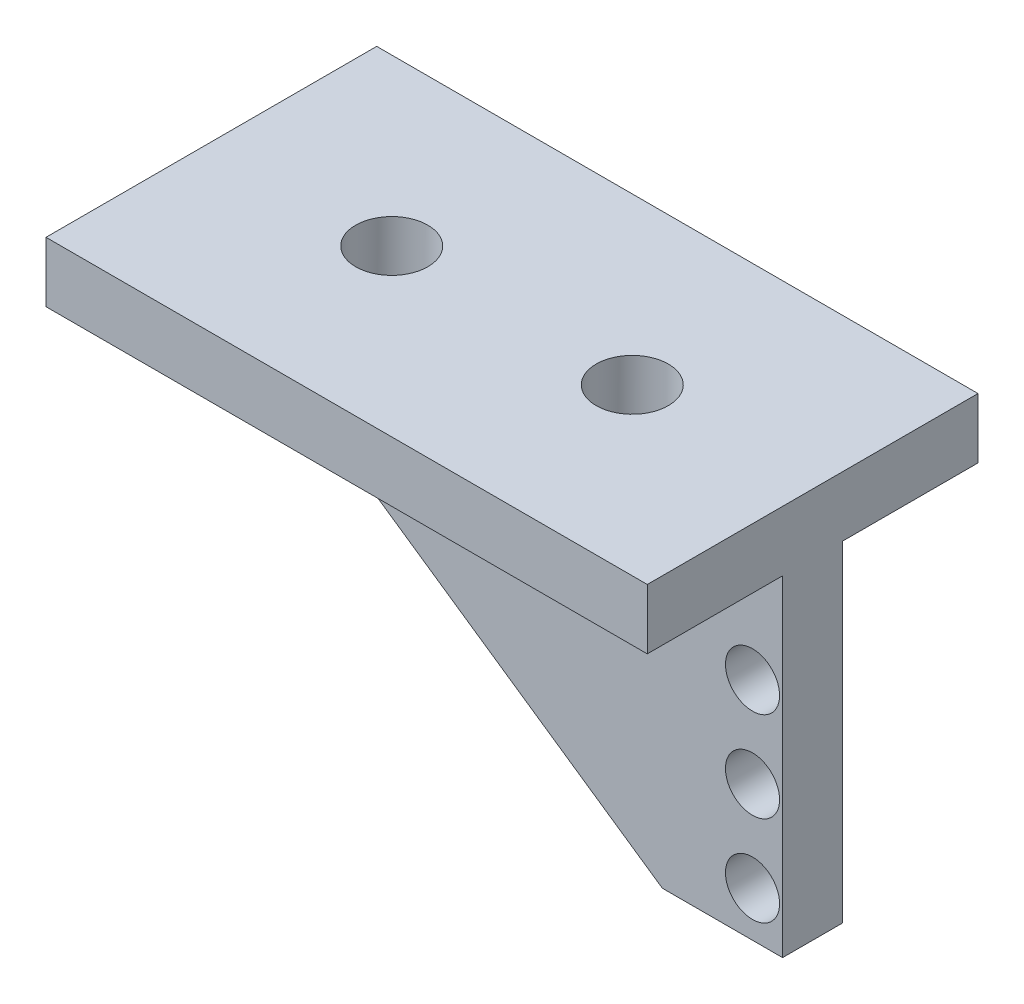
from build123d import *

# Parameters (mm, degrees)
SKETCH1_W           = 20
SKETCH1_H           = 11
BOSS_EXTRUDE1_DEPTH = 2
BOSS_EXTRUDE2_DEPTH = 2
SKETCH3_R           = 0.9
CUT_EXTRUDE1_DEPTH  = 2
SKETCH4_R           = 1.2
CUT_EXTRUDE2_DEPTH  = 2


with BuildPart() as part:
    # Sketch1 → Boss-Extrude1 (new body)
    with BuildSketch(Plane(origin=(0, 0, 0), x_dir=(1, 0, 0), z_dir=(0, 1, 0))):
        with Locations((-10, 0)):
            Rectangle(SKETCH1_W, SKETCH1_H)
    extrude(amount=-BOSS_EXTRUDE1_DEPTH)

    # Sketch2 → Boss-Extrude2 (add)
    with BuildSketch(Plane.XY.offset(-1)):
        Polygon((0, 0), (0, -13), (-4, -13), (-20, -2), (-20, 0), align=None)
    extrude(amount=BOSS_EXTRUDE2_DEPTH)

    # Sketch3 → Cut-Extrude1 (cut)
    with BuildSketch(Plane.XY.offset(-1)):
        with Locations((-1, -5.5)):
            Circle(SKETCH3_R)
        with Locations((-1, -8.5)):
            Circle(SKETCH3_R)
        with Locations((-1, -11.5)):
            Circle(SKETCH3_R)
    extrude(amount=CUT_EXTRUDE1_DEPTH, mode=Mode.SUBTRACT)

    # Sketch4 → Cut-Extrude2 (cut)
    with BuildSketch(Plane(origin=(0, 0, 0), x_dir=(1, 0, 0), z_dir=(0, 1, 0))):
        with Locations(Location((-6, 0, 0), (0, 0, 270))):
            Circle(SKETCH4_R)
        with Locations(Location((-14, 0, 0), (0, 0, 270))):
            Circle(SKETCH4_R)
    extrude(amount=-CUT_EXTRUDE2_DEPTH, mode=Mode.SUBTRACT)


solid = part.part
